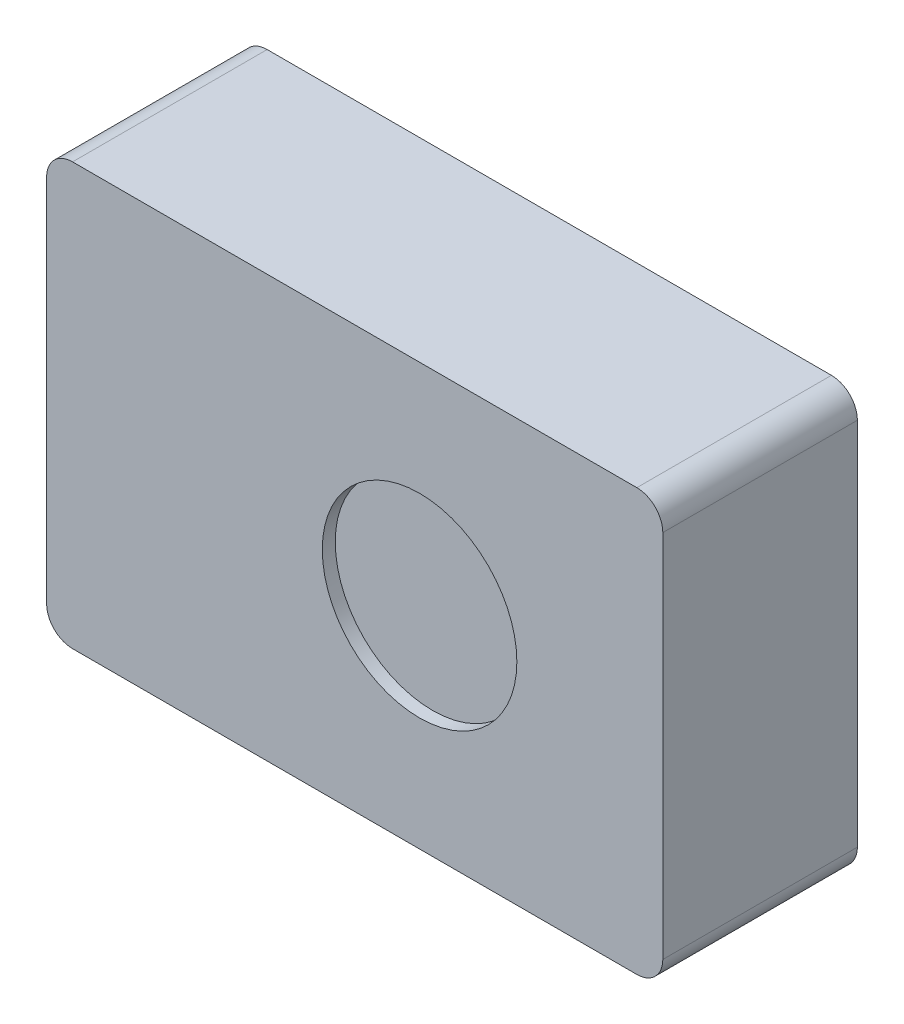
from build123d import *

# Parameters (mm, degrees)
ENVOLVENTE_95X65X30_DEPTH = 30
VENTILADOR_START          = 28
CROQUIS2_R                = 15
VENTILADOR_DEPTH          = 2


with BuildPart() as part:
    # Croquis1 → Envolvente_95x65x30 (new body)
    with BuildSketch(Plane.XY):
        with BuildLine():
            Line((-43.5, -32.5), (43.5, -32.5))
            ThreePointArc((43.5, -32.5), (46.328427125, -31.328427125), (47.5, -28.5))
            Line((47.5, -28.5), (47.5, 28.5))
            ThreePointArc((47.5, 28.5), (46.328427125, 31.328427125), (43.5, 32.5))
            Line((43.5, 32.5), (-43.5, 32.5))
            ThreePointArc((-43.5, 32.5), (-46.328427125, 31.328427125), (-47.5, 28.5))
            Line((-47.5, 28.5), (-47.5, -28.5))
            ThreePointArc((-47.5, -28.5), (-46.328427125, -31.328427125), (-43.5, -32.5))
        make_face()
    extrude(amount=ENVOLVENTE_95X65X30_DEPTH)

    # Croquis2 → Ventilador (cut)
    with BuildSketch(Plane.XY.offset(VENTILADOR_START)):
        with Locations((10, 0)):
            Circle(CROQUIS2_R)
    extrude(amount=VENTILADOR_DEPTH, mode=Mode.SUBTRACT)


solid = part.part
